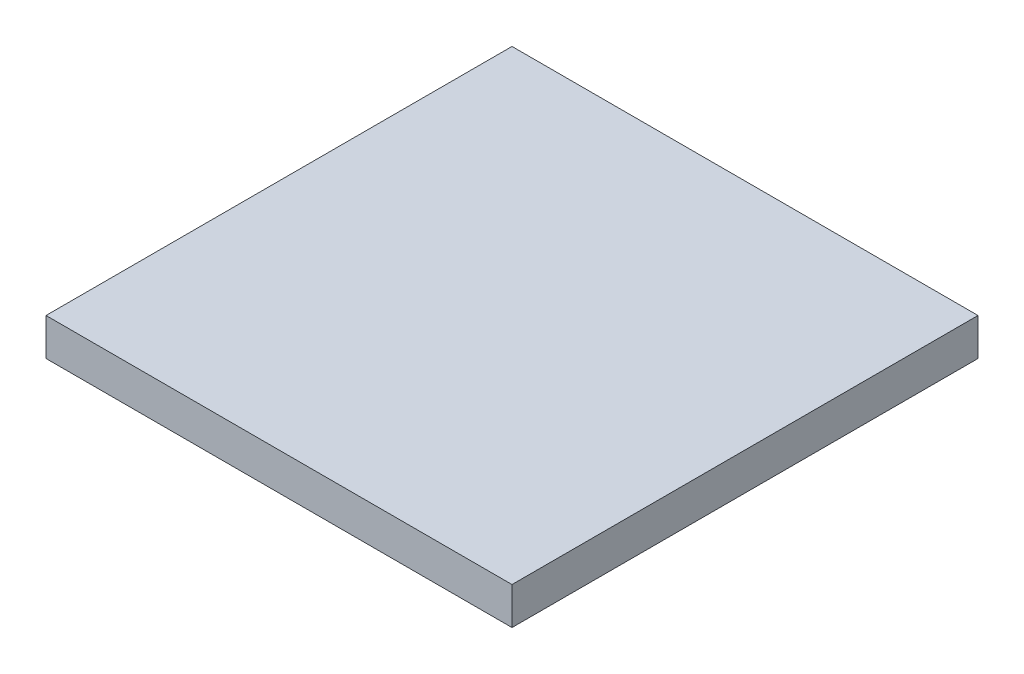
from build123d import *

# Parameters (mm, degrees)
SKETCH2_W           = 37.5
SKETCH2_H           = 37.5
BOSS_EXTRUDE1_DEPTH = 3


with BuildPart() as part:
    # Sketch2 → Boss-Extrude1 (new body)
    with BuildSketch(Plane(origin=(0, 0, 0), x_dir=(1, 0, 0), z_dir=(0, 1, 0))):
        with Locations((18.75, 18.75)):
            Rectangle(SKETCH2_W, SKETCH2_H)
    extrude(amount=BOSS_EXTRUDE1_DEPTH)


solid = part.part
